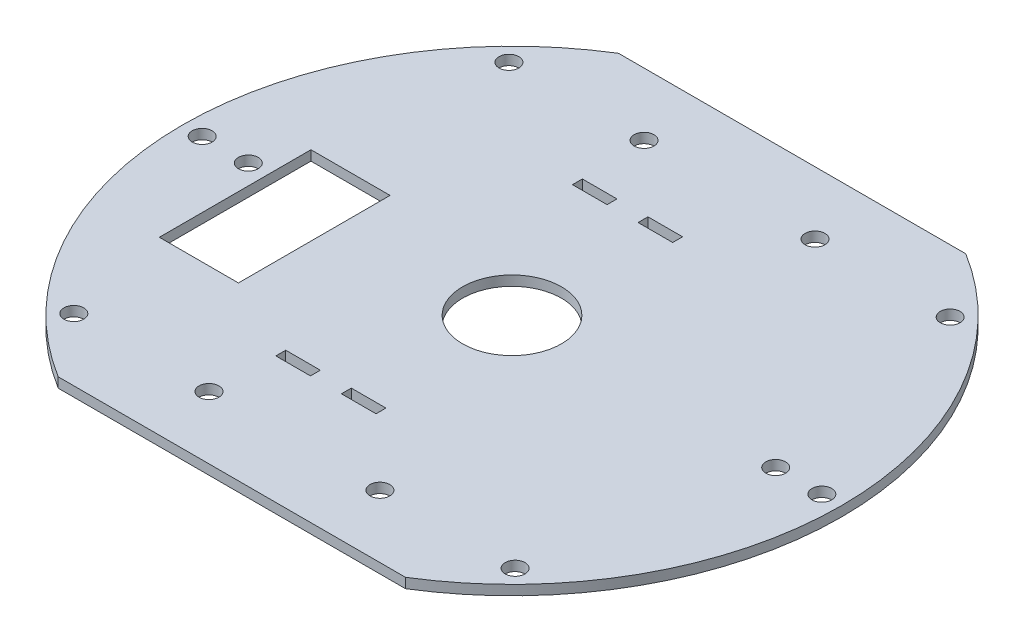
from build123d import *

# Parameters (mm, degrees)
BOSS_EXTRUDE1_DEPTH = 1.5
SKETCH3_R           = 7.5
SKETCH3_R_2         = 1.5
SKETCH3_W           = 12
SKETCH3_H           = 23
SKETCH3_W_2         = 5.25
SKETCH3_H_2         = 1.5
CUT_EXTRUDE1_DEPTH  = 66.639165138


with BuildPart() as part:
    # Sketch2 → Boss-Extrude1 (new body)
    with BuildSketch(Plane(origin=(0, 0, 0), x_dir=(1, 0, 0), z_dir=(0, 1, 0))):
        with BuildLine():
            Line((-26.339134382, 42.5), (26.339134382, 42.5))
            ThreePointArc((26.339134382, 42.5), (50, 0), (26.339134382, -42.5))
            Line((26.339134382, -42.5), (-26.339134382, -42.5))
            ThreePointArc((-26.339134382, -42.5), (-50, 0), (-26.339134382, 42.5))
        make_face()
    extrude(amount=BOSS_EXTRUDE1_DEPTH)

    # Sketch3 → Cut-Extrude1 (cut, through all)
    with BuildSketch(Plane(origin=(0, 1.5, 0), x_dir=(1, 0, 0), z_dir=(0, 1, 0))):
        with Locations(Location((0, 0, 0), (0, 0, 270))):
            Circle(SKETCH3_R)
        with Locations(Location((-47, 0, 0), (0, 0, 270))):
            Circle(SKETCH3_R_2)
        with Locations(Location((-33.466401061, 33, 0), (0, 0, 270))):
            Circle(SKETCH3_R_2)
        with Locations(Location((-12.966401061, 33, 0), (0, 0, 270))):
            Circle(SKETCH3_R_2)
        with Locations(Location((-40, 0, 0), (0, 0, 270))):
            Circle(SKETCH3_R_2)
        with Locations(Location((-12.966401061, -33, 0), (0, 0, 90))):
            Circle(SKETCH3_R_2)
        with Locations(Location((-33.466401061, -33, 0), (0, 0, 90))):
            Circle(SKETCH3_R_2)
        with Locations(Location((33.466401061, 33, 0), (0, 0, 90))):
            Circle(SKETCH3_R_2)
        with Locations(Location((12.966401061, 33, 0), (0, 0, 90))):
            Circle(SKETCH3_R_2)
        with Locations(Location((12.966401061, -33, 0), (0, 0, 270))):
            Circle(SKETCH3_R_2)
        with Locations(Location((33.466401061, -33, 0), (0, 0, 270))):
            Circle(SKETCH3_R_2)
        with Locations(Location((40, 0, 0), (0, 0, 90))):
            Circle(SKETCH3_R_2)
        with Locations(Location((47, 0, 0), (0, 0, 90))):
            Circle(SKETCH3_R_2)
        with Locations((-31, -5)):
            Rectangle(SKETCH3_W, SKETCH3_H)
        with Locations((0, -22.5)):
            Rectangle(SKETCH3_W_2, SKETCH3_H_2)
        with Locations((-9.95, 22.5)):
            Rectangle(SKETCH3_W_2, SKETCH3_H_2)
        with Locations((0, 22.5)):
            Rectangle(SKETCH3_W_2, SKETCH3_H_2)
        with Locations((-9.95, -22.5)):
            Rectangle(SKETCH3_W_2, SKETCH3_H_2)
    extrude(amount=-CUT_EXTRUDE1_DEPTH, mode=Mode.SUBTRACT)


solid = part.part
